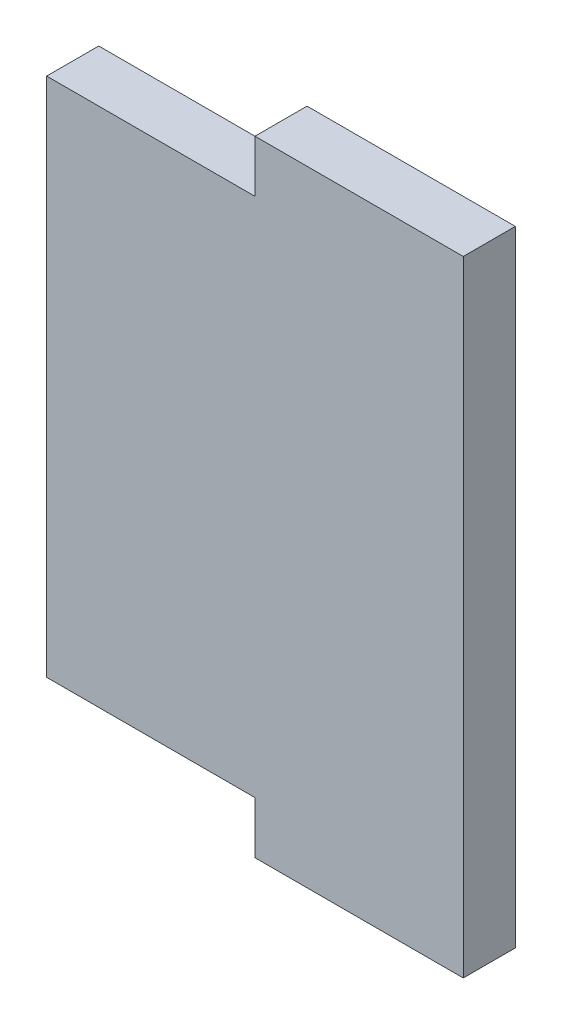
from build123d import *

# Parameters (mm, degrees)
BOSS_EXTRUDE1_DEPTH = 3.175


with BuildPart() as part:
    # Sketch1 → Boss-Extrude1 (new body)
    with BuildSketch(Plane.XY):
        Polygon((174.625, 0), (161.925, 0), (161.925, -3.175), (149.225, -3.175), (149.225, -34.925), (161.925, -34.925), (161.925, -38.1), (174.625, -38.1), align=None)
    extrude(amount=BOSS_EXTRUDE1_DEPTH)


solid = part.part
